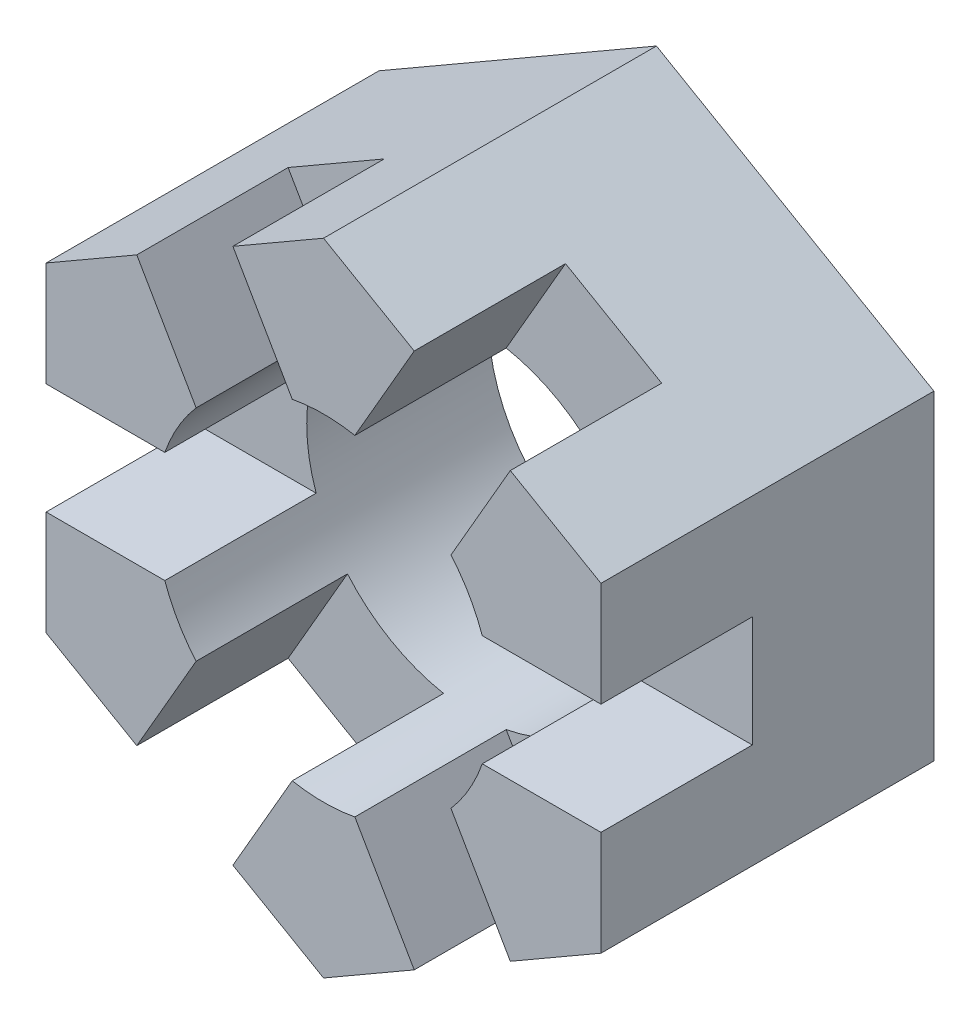
from build123d import *

# Parameters (mm, degrees)
EXTRUDE_1_DEPTH   = 4.5
EXTRUDE_1_2_DEPTH = 4.5
EXTRUDE_1_3_DEPTH = 4.5
EXTRUDE_1_4_DEPTH = 4.5
EXTRUDE_1_5_DEPTH = 4.5
EXTRUDE_1_6_DEPTH = 4.5
EXTRUDE_START     = -5.4
SKETCH_1_4_R      = 5
EXTRUDE_2_DEPTH   = 5.4


with BuildPart() as part:
    # 草图1 → 凸台-拉伸1 (new body)
    with BuildSketch(Plane.XY):
        with BuildLine():
            Line((-2.696058084, -7.969709581), (0, -9.526279442))
            Line((0, -9.526279442), (2.696058084, -7.969709581))
            Line((2.696058084, -7.969709581), (0.931010414, -4.912557339))
            ThreePointArc((0.931010414, -4.912557339), (0, -5), (-0.931010414, -4.912557339))
            Line((-0.931010414, -4.912557339), (-2.696058084, -7.969709581))
        make_face()
    extrude(amount=EXTRUDE_1_DEPTH)



with BuildPart() as body_2:
    # 草图1 → Extrude 1 2 (new body)
    with BuildSketch(Plane.XY):
        with BuildLine():
            Line((3.788894246, -3.262557339), (5.553941916, -6.319709581))
            Line((5.553941916, -6.319709581), (8.25, -4.763139721))
            Line((8.25, -4.763139721), (8.25, -1.65))
            Line((8.25, -1.65), (4.71990466, -1.65))
            ThreePointArc((4.71990466, -1.65), (4.330127019, -2.5), (3.788894246, -3.262557339))
        make_face()
    extrude(amount=EXTRUDE_1_2_DEPTH)


with BuildPart() as body_3:
    # 草图1 → Extrude 1 3 (new body)
    with BuildSketch(Plane.XY):
        with BuildLine():
            Line((-8.25, -4.763139721), (-5.553941916, -6.319709581))
            Line((-5.553941916, -6.319709581), (-3.788894246, -3.262557339))
            ThreePointArc((-3.788894246, -3.262557339), (-4.330127019, -2.5), (-4.71990466, -1.65))
            Line((-4.71990466, -1.65), (-8.25, -1.65))
            Line((-8.25, -1.65), (-8.25, -4.763139721))
        make_face()
    extrude(amount=EXTRUDE_1_3_DEPTH)


with BuildPart() as body_4:
    # 草图1 → Extrude 1 4 (new body)
    with BuildSketch(Plane.XY):
        with BuildLine():
            Line((4.71990466, 1.65), (8.25, 1.65))
            Line((8.25, 1.65), (8.25, 4.763139721))
            Line((8.25, 4.763139721), (5.553941916, 6.319709581))
            Line((5.553941916, 6.319709581), (3.788894246, 3.262557339))
            ThreePointArc((3.788894246, 3.262557339), (4.330127019, 2.5), (4.71990466, 1.65))
        make_face()
    extrude(amount=EXTRUDE_1_4_DEPTH)


with BuildPart() as body_5:
    # 草图1 → Extrude 1 5 (new body)
    with BuildSketch(Plane.XY):
        with BuildLine():
            Line((-8.25, 4.763139721), (-8.25, 1.65))
            Line((-8.25, 1.65), (-4.71990466, 1.65))
            ThreePointArc((-4.71990466, 1.65), (-4.330127019, 2.5), (-3.788894246, 3.262557339))
            Line((-3.788894246, 3.262557339), (-5.553941916, 6.319709581))
            Line((-5.553941916, 6.319709581), (-8.25, 4.763139721))
        make_face()
    extrude(amount=EXTRUDE_1_5_DEPTH)


with BuildPart() as body_6:
    # 草图1 → Extrude 1 6 (new body)
    with BuildSketch(Plane.XY):
        with BuildLine():
            Line((-2.696058084, 7.969709581), (-0.931010414, 4.912557339))
            ThreePointArc((-0.931010414, 4.912557339), (0, 5), (0.931010414, 4.912557339))
            Line((0.931010414, 4.912557339), (2.696058084, 7.969709581))
            Line((2.696058084, 7.969709581), (0, 9.526279442))
            Line((0, 9.526279442), (-2.696058084, 7.969709581))
        make_face()
    extrude(amount=EXTRUDE_1_6_DEPTH)


with BuildPart() as part_1:
    add(part.part)

    add(body_2.part)  # 凸台-拉伸2 merges body 2

    add(body_3.part)  # 凸台-拉伸2 merges body 3

    add(body_4.part)  # 凸台-拉伸2 merges body 4

    add(body_5.part)  # 凸台-拉伸2 merges body 5

    add(body_6.part)  # 凸台-拉伸2 merges body 6
    # 草图1<4> → 凸台-拉伸2 (add)
    with BuildSketch(Plane.XY.offset(EXTRUDE_START)):
        Polygon((0, -9.526279442), (8.25, -4.763139721), (8.25, 4.763139721), (0, 9.526279442), (-8.25, 4.763139721), (-8.25, -4.763139721), align=None)
        Circle(SKETCH_1_4_R, mode=Mode.SUBTRACT)
    extrude(amount=EXTRUDE_2_DEPTH)


solid = part_1.part
